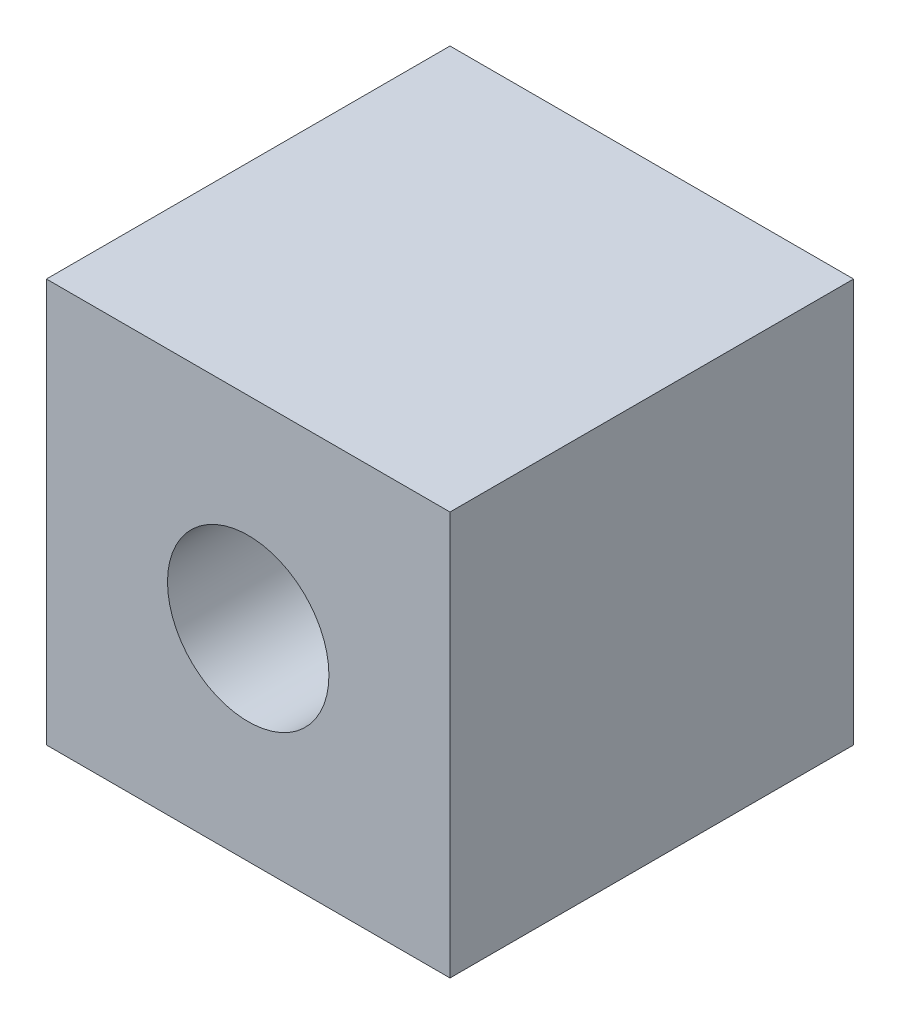
from build123d import *

# Parameters (mm, degrees)
SKETCH_1_W          = 50
SKETCH_1_H          = 50
EXTRUDE_1_DEPTH     = 50
SKETCH_2_R          = 10
CUT_EXTRUDE_1_DEPTH = 62.23724357


with BuildPart() as part:
    # Эскиз1 → Бобышка-Вытянуть1 (new body)
    with BuildSketch(Plane.XY):
        Rectangle(SKETCH_1_W, SKETCH_1_H)
    extrude(amount=EXTRUDE_1_DEPTH)

    # Эскиз2 → Вырез-Вытянуть1 (cut, through all)
    with BuildSketch(Plane.XY.offset(50)):
        Circle(SKETCH_2_R)
    extrude(amount=-CUT_EXTRUDE_1_DEPTH, mode=Mode.SUBTRACT)


solid = part.part
